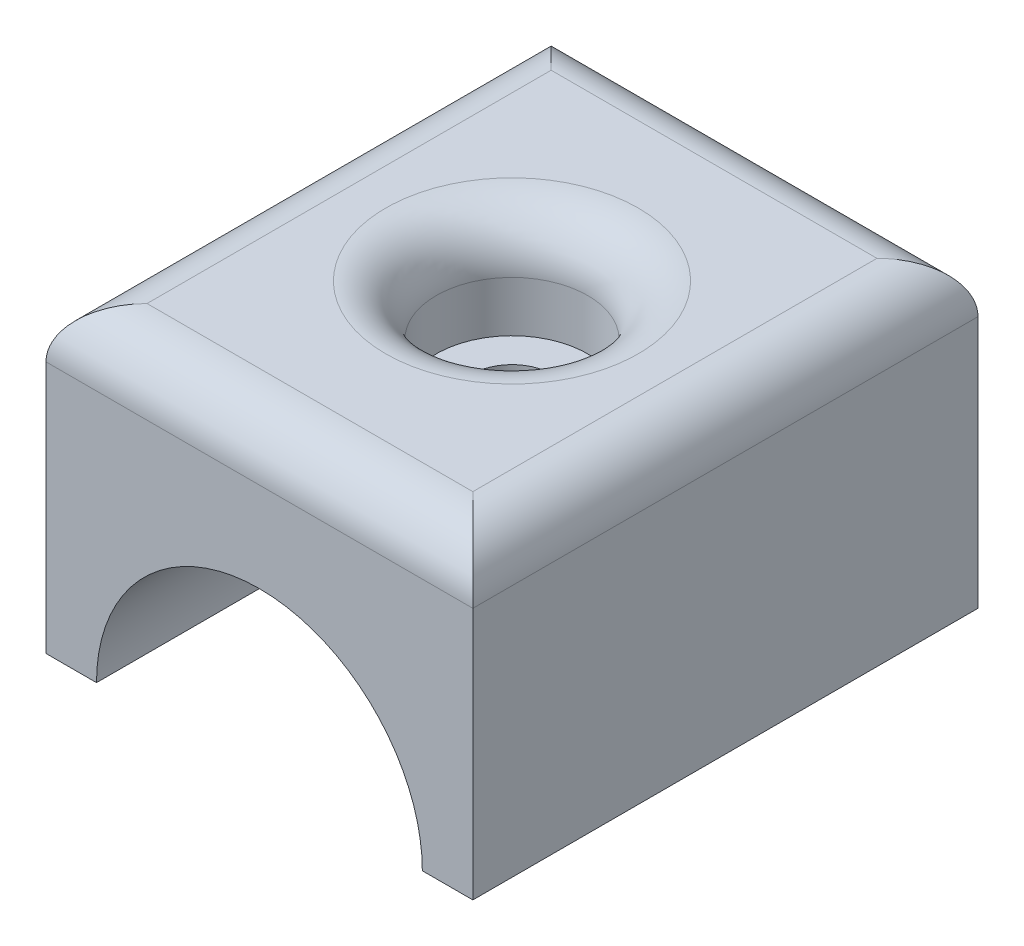
from build123d import *

# Parameters (mm, degrees)
BOSS_EXTRUDE1_DEPTH = 20
SKETCH3_R           = 1.6
CUT_EXTRUDE1_DEPTH  = 20
SKETCH4_R           = 3
CUT_EXTRUDE2_DEPTH  = 4
FILLET5_R           = 2


with BuildPart() as part:
    # Sketch2 → Boss-Extrude1 (new body)
    with BuildSketch(Plane.XY):
        with BuildLine():
            Line((0, 0), (-2, 0))
            Line((-2, 0), (-2, 12))
            Line((-2, 12), (14.9, 12))
            Line((14.9, 12), (14.9, 0))
            Line((14.9, 0), (12.9, 0))
            ThreePointArc((12.9, 0), (6.45, 6.45), (0, 0))
        make_face()
    extrude(amount=-BOSS_EXTRUDE1_DEPTH)

    # Sketch3 → Cut-Extrude1 (cut)
    with BuildSketch(Plane(origin=(0, 12, 0), x_dir=(1, 0, 0), z_dir=(0, 1, 0))):
        with Locations(Location((6.45, 10, 0), (0, 0, 270))):
            Circle(SKETCH3_R)
    extrude(amount=-CUT_EXTRUDE1_DEPTH, mode=Mode.SUBTRACT)

    # Sketch4 → Cut-Extrude2 (cut)
    with BuildSketch(Plane(origin=(0, 12, 0), x_dir=(1, 0, 0), z_dir=(0, 1, 0))):
        with Locations(Location((6.45, 10, 0), (0, 0, 270))):
            Circle(SKETCH4_R)
    extrude(amount=-CUT_EXTRUDE2_DEPTH, mode=Mode.SUBTRACT)

    # Fillet5
    fillet5_edges = [part.edges().sort_by_distance(p)[0] for p in [
        (-2, 12, -10),
        (14.9, 12, -10),
        (6.45, 12, -20),
        (6.45, 12, -13),
        (6.45, 12, 0),
    ]]
    fillet(fillet5_edges, radius=FILLET5_R)


solid = part.part
